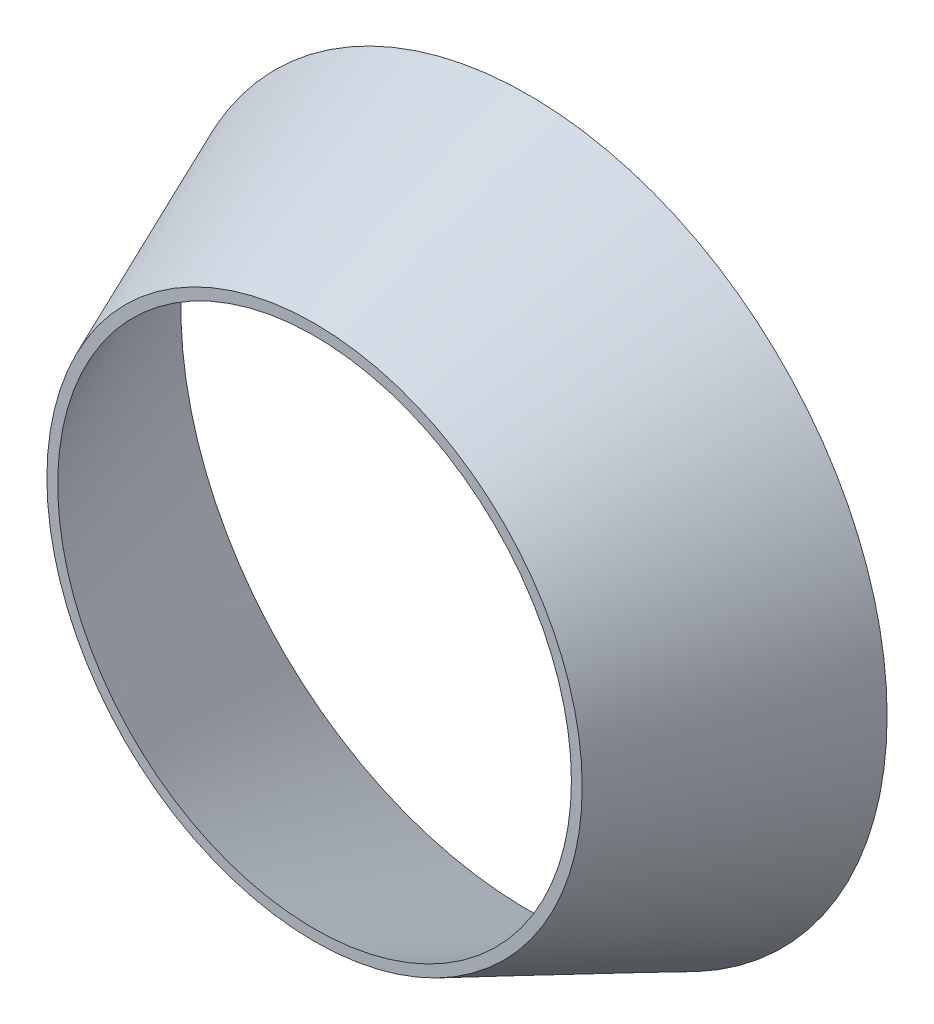
from build123d import *

# Parameters (mm, degrees)
SKETCH1_R           = 5105.4
BOSS_EXTRUDE2_DEPTH = 3048
BOSS_EXTRUDE2_TAPER = 23
SKETCH2_R           = 3657.6
CUT_EXTRUDE1_DEPTH  = 3048
CUT_EXTRUDE1_DRAFT  = 23


with BuildPart() as part:
    # Sketch1 → Boss-Extrude2 (new body)
    with BuildSketch(Plane.XY):
        Circle(SKETCH1_R)
    extrude(amount=BOSS_EXTRUDE2_DEPTH, taper=BOSS_EXTRUDE2_TAPER)


with BuildPart() as cut_extrude1_tool:
    # Sketch2 → Cut-Extrude1 (with draft: the straight prism first)
    with BuildSketch(Plane.XY.offset(3048)):
        Circle(SKETCH2_R)
    extrude(amount=-CUT_EXTRUDE1_DEPTH)
    # Cut-Extrude1: the draft: its side faces are tilted about the plane it starts from
    cut_extrude1_sides = [cut_extrude1_tool.faces().sort_by_distance(p)[0] for p in [
        (-3657.6, 0, 1524),
    ]]
    draft(cut_extrude1_sides, Plane.XY.offset(3048), CUT_EXTRUDE1_DRAFT)


with BuildPart() as part_1:
    add(part.part)

    # Cut-Extrude1: cut by cut_extrude1_tool
    add(cut_extrude1_tool.part, mode=Mode.SUBTRACT)


solid = part_1.part
